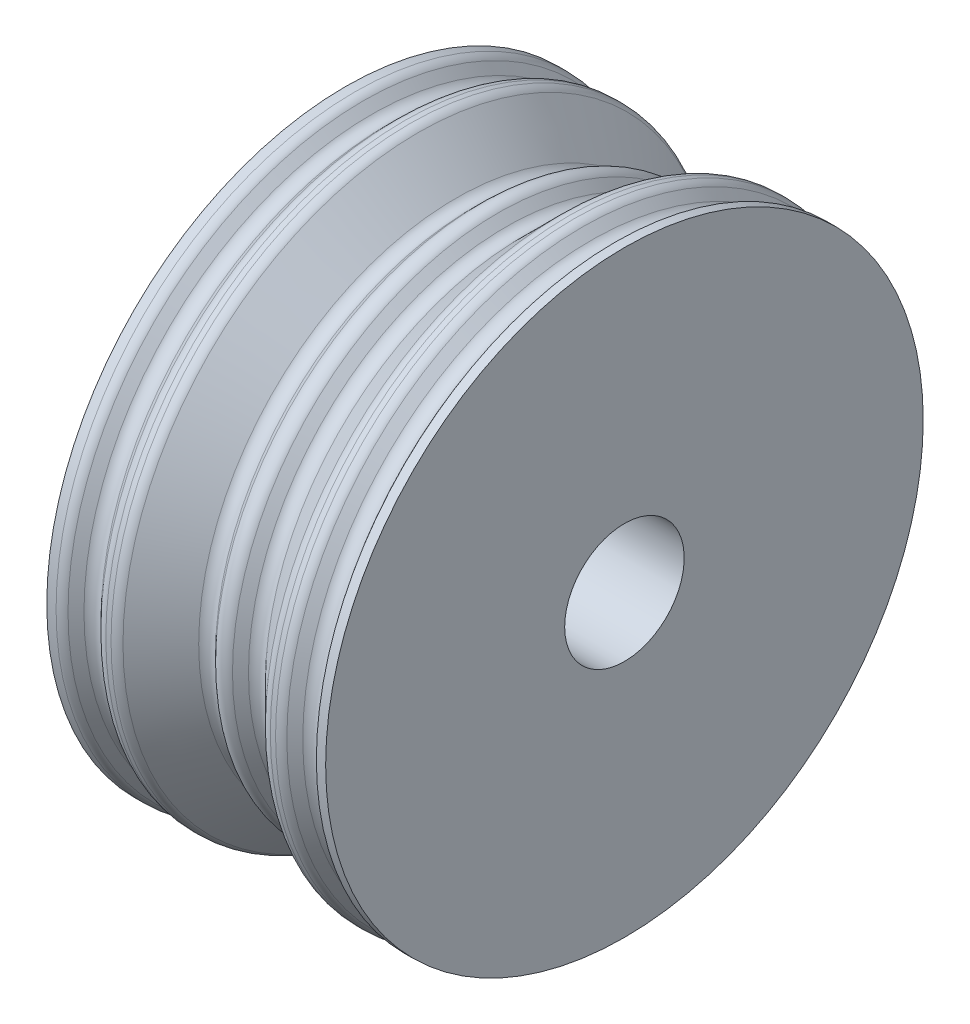
from build123d import *


with BuildPart() as part:
    # Sketch1 → Revolve1 (revolve)
    with BuildSketch(Plane.XY, mode=Mode.PRIVATE) as revolve1_sk:
        with BuildLine():
            Line((0, 3.81), (0, 19.05))
            Line((0, 19.05), (0.59261541, 19.05))
            ThreePointArc((0.59261541, 19.05), (0.884220186, 18.991996204), (1.131430777, 18.826815367))
            Line((1.131430777, 18.826815367), (1.639430777, 18.318815367))
            ThreePointArc((1.639430777, 18.318815367), (2.178246145, 18.095630735), (2.717061512, 18.318815367))
            Line((2.717061512, 18.318815367), (3.225061512, 18.826815367))
            ThreePointArc((3.225061512, 18.826815367), (3.472272104, 18.991996204), (3.763876879, 19.05))
            Line((3.763876879, 19.05), (4.096971856, 19.05))
            ThreePointArc((4.096971856, 19.05), (4.388576631, 18.991996204), (4.635787223, 18.826815367))
            Line((4.635787223, 18.826815367), (7.048787223, 16.413815367))
            ThreePointArc((7.048787223, 16.413815367), (7.58760259, 16.190630735), (8.126417958, 16.413815367))
            Line((8.126417958, 16.413815367), (8.636287223, 16.923684633))
            ThreePointArc((8.636287223, 16.923684633), (9.17510259, 17.146869265), (9.713917958, 16.923684633))
            Line((9.713917958, 16.923684633), (10.223787223, 16.413815367))
            ThreePointArc((10.223787223, 16.413815367), (10.76260259, 16.190630735), (11.301417958, 16.413815367))
            Line((11.301417958, 16.413815367), (13.714417958, 18.826815367))
            ThreePointArc((13.714417958, 18.826815367), (13.961628549, 18.991996204), (14.253233325, 19.05))
            Line((14.253233325, 19.05), (14.586328302, 19.05))
            ThreePointArc((14.586328302, 19.05), (14.863983576, 18.997613661), (15.103462097, 18.847657608))
            Line((15.103462097, 18.847657608), (15.63111235, 18.36009919))
            ThreePointArc((15.63111235, 18.36009919), (16.22188765, 18.161323591), (16.763387099, 18.470039546))
            Line((16.763387099, 18.470039546), (17.18738459, 19.05))
            Line((17.18738459, 19.05), (17.78, 19.05))
            Line((17.78, 19.05), (17.78, 3.81))
            Line((17.78, 3.81), (0, 3.81))
        make_face()
    revolve(revolve1_sk.sketch.rotate(Axis((0, 0, 0), (1, 0, 0)), 90), axis=Axis((0, 0, 0), (1, 0, 0)))


solid = part.part
